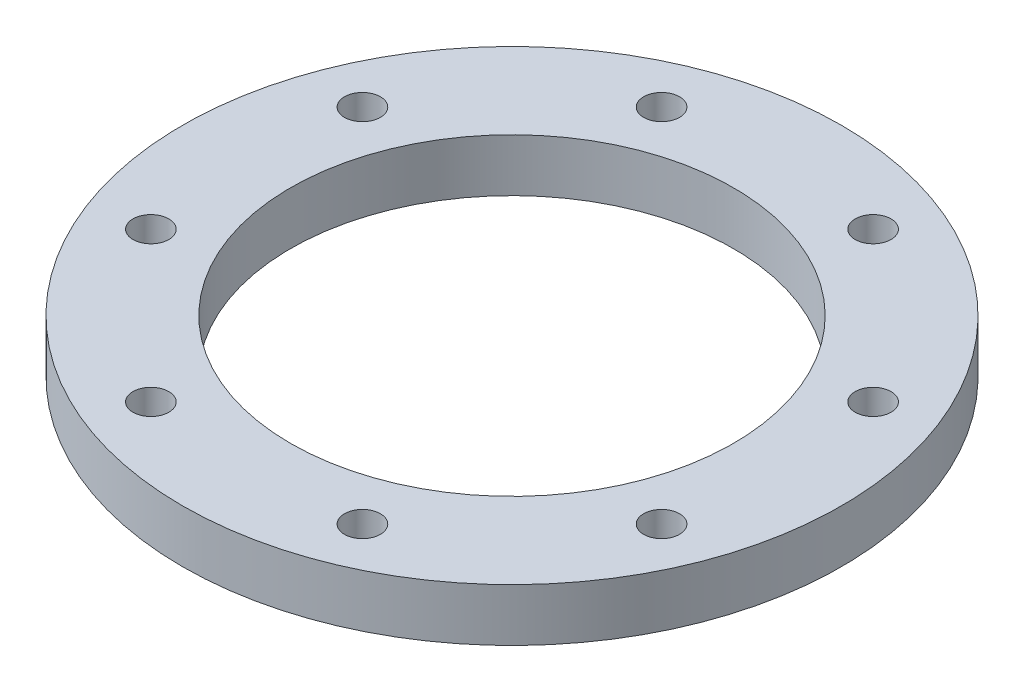
from build123d import *

# Parameters (mm, degrees)
SZKIC1_W               = 20.5
SZKIC1_H               = 10
OTW_R_GWINTOWANY_M81_D = 6.8


with BuildPart() as part:
    # Szkic1 → Obrót1 (revolve)
    with BuildSketch(Plane.XY, mode=Mode.PRIVATE) as obr_t1_sk:
        with Locations((-52.25, -1.619007804)):
            Rectangle(SZKIC1_W, SZKIC1_H)
    revolve(obr_t1_sk.sketch.rotate(Axis((0, 12.15490524, 0), (0, -1, 0)), 270), axis=Axis((0, 12.15490524, 0), (0, -1, 0)))

    # Otwór gwintowany M81 (through all)
    with Locations(Plane(origin=(-20.058639265, 3.380992196, -48.425838957), x_dir=(0, 0, 1), z_dir=(0, 1, 0))):
        with Locations((0, 0), (0, 40.11727853), (28.367199692, 68.484478222), (68.484478222, 68.484478222), (96.851677914, 40.11727853), (96.851677914, 0), (68.484478222, -28.367199692), (28.367199692, -28.367199692)):
            Hole(OTW_R_GWINTOWANY_M81_D / 2)


solid = part.part
